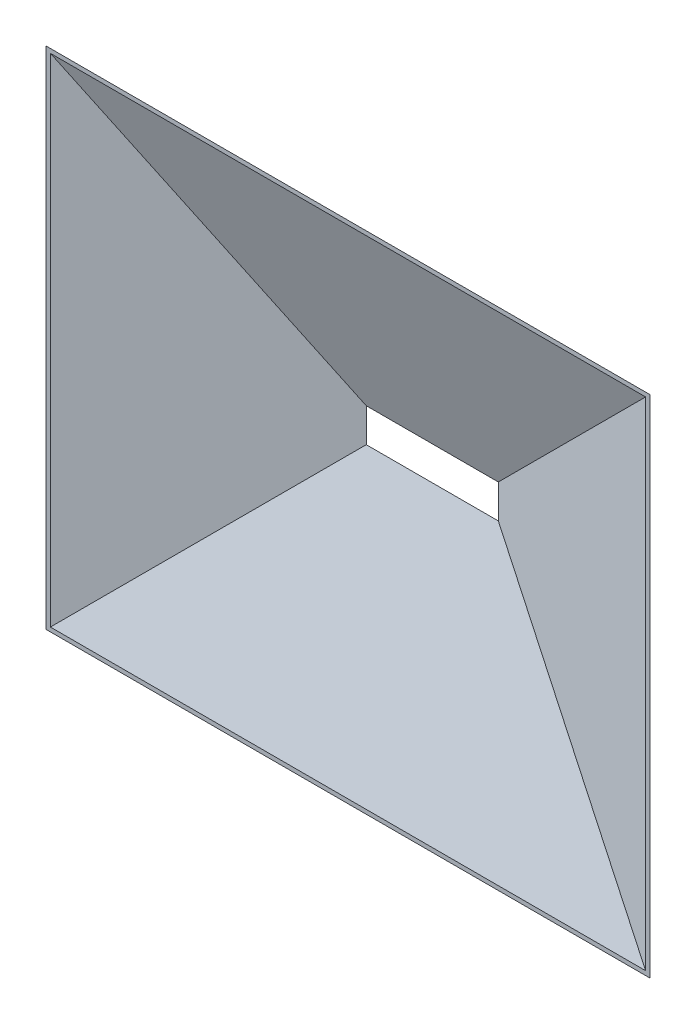
from build123d import *

# Parameters (mm, degrees)
CROQUIS1_W              = 100
CROQUIS1_H              = 30
SALIENTE_EXTRUIR1_DEPTH = 60
SALIENTE_EXTRUIR1_TAPER = -70
CROQUIS2_W              = 94
CROQUIS2_H              = 24
CORTAR_EXTRUIR1_DEPTH   = 60
CORTAR_EXTRUIR1_TAPER   = -70


with BuildPart() as part:
    # Croquis1 → Saliente-Extruir1 (new body)
    with BuildSketch(Plane.XY):
        Rectangle(CROQUIS1_W, CROQUIS1_H)
    extrude(amount=SALIENTE_EXTRUIR1_DEPTH, taper=SALIENTE_EXTRUIR1_TAPER)

    # Croquis2 → Cortar-Extruir1 (cut)
    with BuildSketch(Plane(origin=(0, 0, 0), x_dir=(-1, 0, 0), z_dir=(0, 0, -1))):
        Rectangle(CROQUIS2_W, CROQUIS2_H)
    extrude(amount=-CORTAR_EXTRUIR1_DEPTH, taper=CORTAR_EXTRUIR1_TAPER, mode=Mode.SUBTRACT)


solid = part.part
